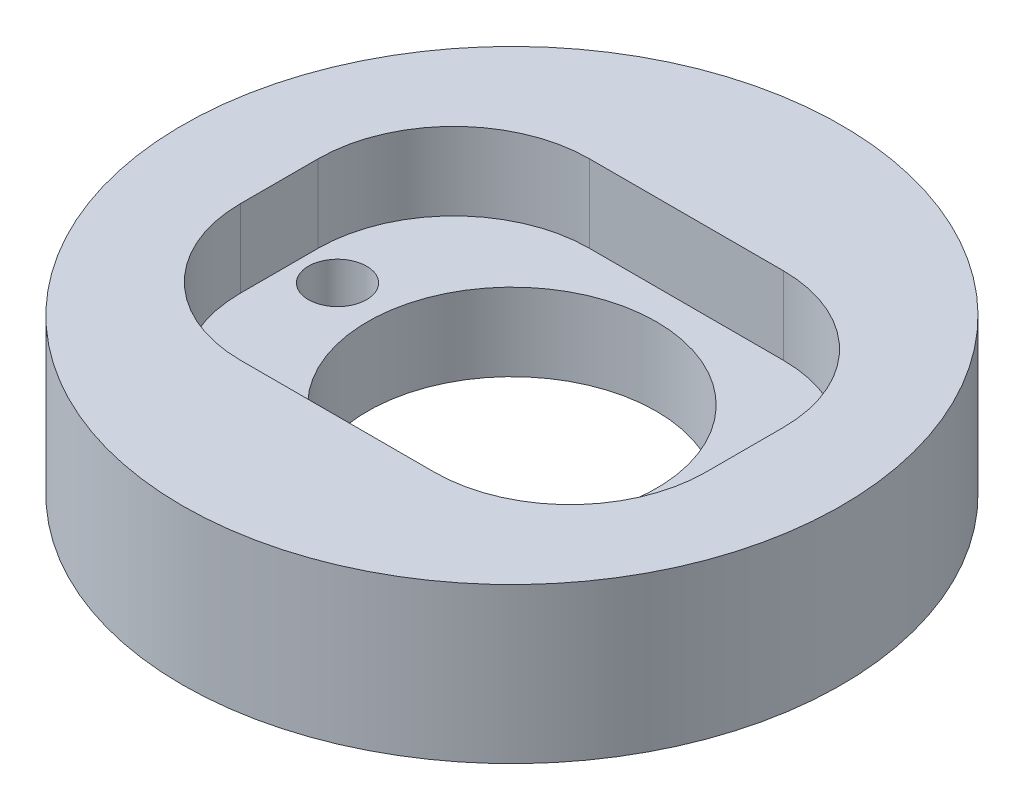
from build123d import *

# Parameters (mm, degrees)
SKETCH2_R           = 8.5
BOSS_EXTRUDE1_DEPTH = 4
SKETCH3_W           = 12
SKETCH3_H           = 9
CUT_EXTRUDE1_DEPTH  = 2
FILLET1_R           = 3.5
SKETCH4_R           = 3.725
SKETCH4_R_2         = 0.75
CUT_EXTRUDE2_DEPTH  = 13.186057607


with BuildPart() as part:
    # Sketch2 → Boss-Extrude1 (new body)
    with BuildSketch(Plane(origin=(0, 0, 0), x_dir=(1, 0, 0), z_dir=(0, 1, 0))):
        with Locations(Location((0, 0, 0), (0, 0, 270))):
            Circle(SKETCH2_R)
    extrude(amount=BOSS_EXTRUDE1_DEPTH)

    # Sketch3 → Cut-Extrude1 (cut)
    with BuildSketch(Plane(origin=(0, 4, 0), x_dir=(1, 0, 0), z_dir=(0, 1, 0))):
        Rectangle(SKETCH3_W, SKETCH3_H)
    extrude(amount=-CUT_EXTRUDE1_DEPTH, mode=Mode.SUBTRACT)

    # Fillet1
    fillet1_edges = [part.edges().sort_by_distance(p)[0] for p in [
        (6, 3, -4.5),
        (6, 3, 4.5),
        (-6, 3, 4.5),
        (-6, 3, -4.5),
    ]]
    fillet(fillet1_edges, radius=FILLET1_R)

    # Sketch4 → Cut-Extrude2 (cut, through all)
    with BuildSketch(Plane(origin=(0, 2, 0), x_dir=(1, 0, 0), z_dir=(0, 1, 0))):
        with Locations(Location((0, 0, 0), (0, 0, 270))):
            Circle(SKETCH4_R)
        with Locations(Location((-4.977045146, 0.478562033, 0), (0, 0, 270))):
            Circle(SKETCH4_R_2)
        with Locations(Location((4.977045146, 0.478562033, 0), (0, 0, 90))):
            Circle(SKETCH4_R_2)
    extrude(amount=-CUT_EXTRUDE2_DEPTH, mode=Mode.SUBTRACT)


solid = part.part
